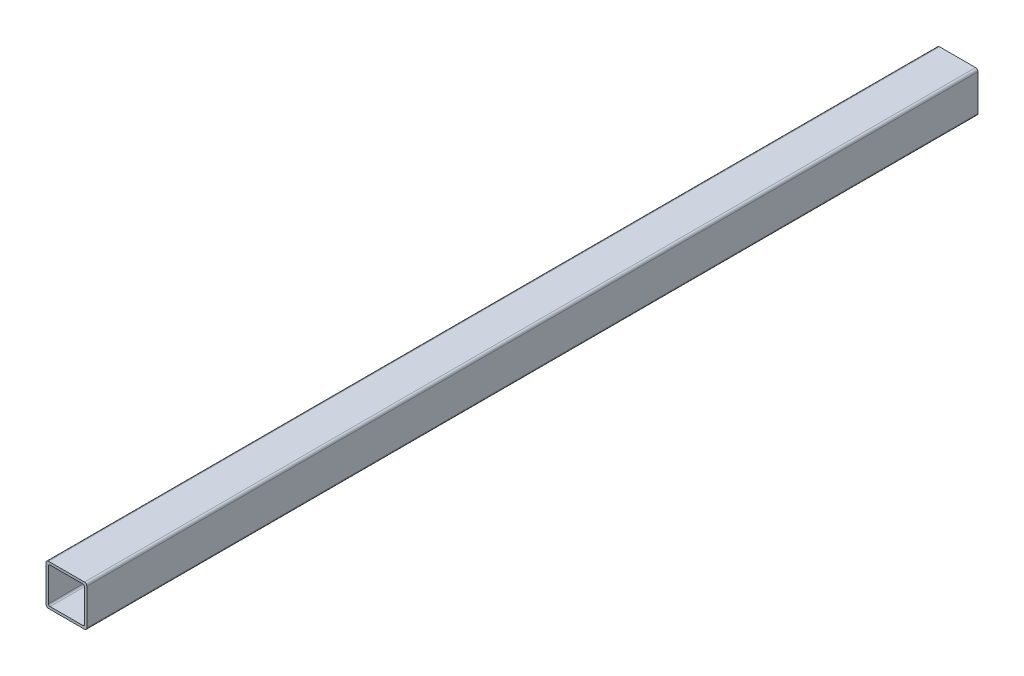
from build123d import *

# Parameters (mm, degrees)
EXTRUDE_1_DEPTH = 1090


with BuildPart() as part:
    # Эскиз1 → Бобышка-Вытянуть1 (new body)
    with BuildSketch(Plane.XY):
        with BuildLine():
            Line((-22, 25), (22, 25))
            ThreePointArc((22, 25), (24.121320344, 24.121320344), (25, 22))
            Line((25, 22), (25, -22))
            ThreePointArc((25, -22), (24.121320344, -24.121320344), (22, -25))
            Line((22, -25), (-22, -25))
            ThreePointArc((-22, -25), (-24.121320344, -24.121320344), (-25, -22))
            Line((-25, -22), (-25, 22))
            ThreePointArc((-25, 22), (-24.121320344, 24.121320344), (-22, 25))
        make_face()
        with BuildLine():
            Line((-20, 22), (20, 22))
            ThreePointArc((20, 22), (21.414213562, 21.414213562), (22, 20))
            Line((22, 20), (22, -20))
            ThreePointArc((22, -20), (21.414213562, -21.414213562), (20, -22))
            Line((20, -22), (-20, -22))
            ThreePointArc((-20, -22), (-21.414213562, -21.414213562), (-22, -20))
            Line((-22, -20), (-22, 20))
            ThreePointArc((-22, 20), (-21.414213562, 21.414213562), (-20, 22))
        make_face(mode=Mode.SUBTRACT)
    extrude(amount=-EXTRUDE_1_DEPTH)


solid = part.part
